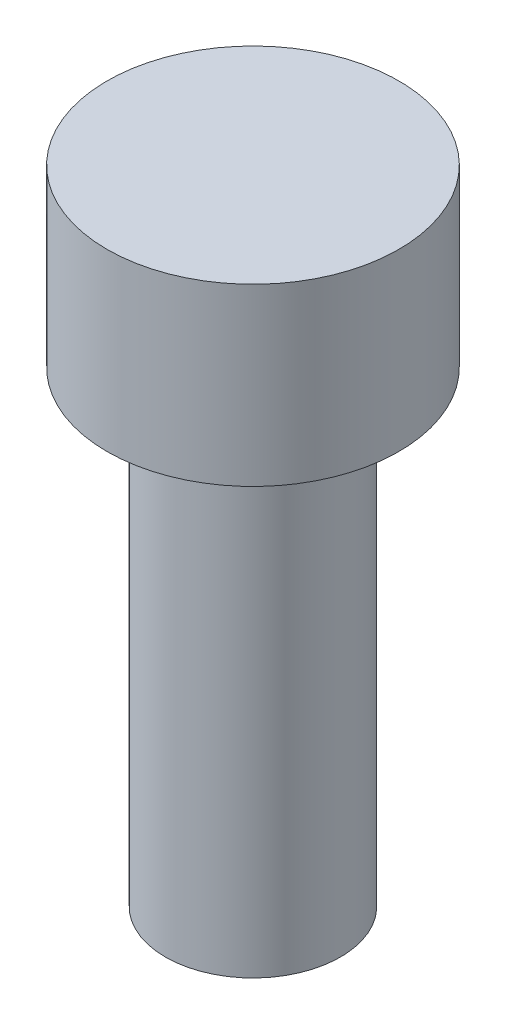
from build123d import *


with BuildPart() as part:
    # Sketch1 → Revolve1 (revolve)
    with BuildSketch(Plane(origin=(0, 0, 0), x_dir=(0, 0, -1), z_dir=(1, 0, 0))):
        Polygon((0, 22), (0, 0), (-3, 0), (-3, 16), (-5, 16), (-5, 22), align=None)
    revolve(axis=Axis((0, 22, 0), (0, -1, 0)))


solid = part.part
